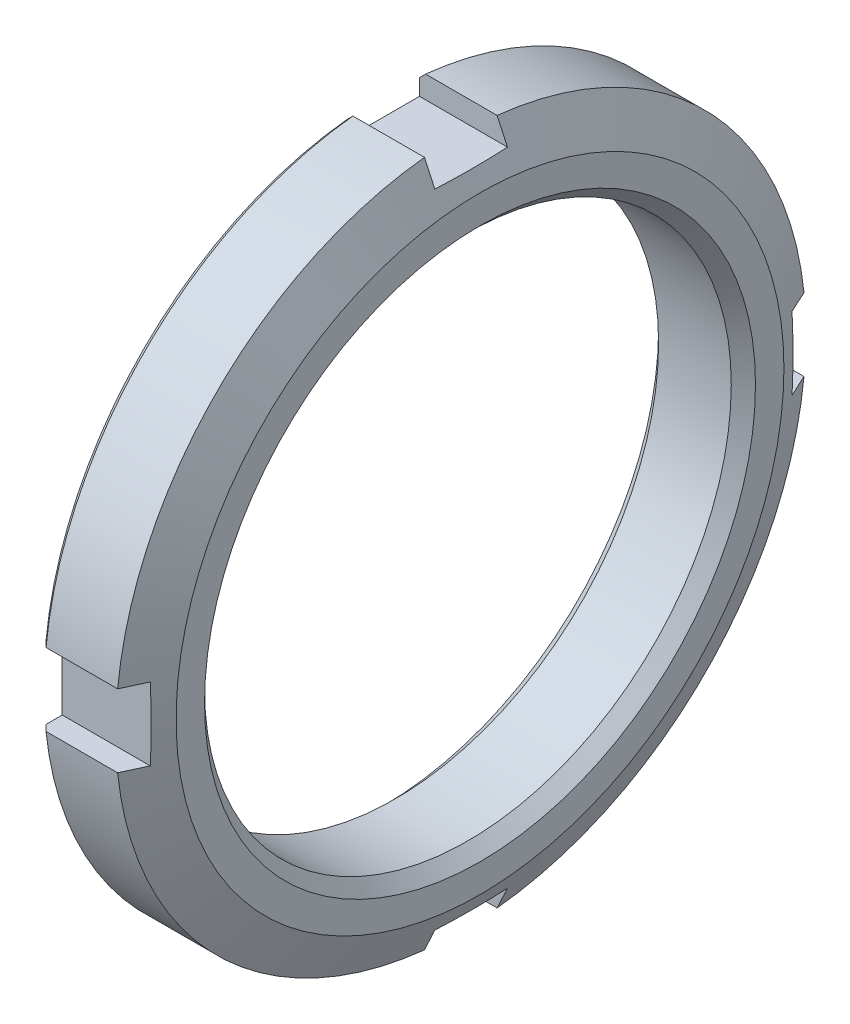
from build123d import *

# Parameters (mm, degrees)
SKETCH_1_R               = 28.5
SKETCH_1_R_2             = 21.75
EXTRUDE_1_DEPTH          = 8
CHAMFER_1_SIZE           = 1
CHAMFER_2_SIZE           = 0.5
CUT_EXTRUDE_START        = -8
CUT_EXTRUDE_1_DEPTH      = 8
PATTERN_CIRCULAR_1_COUNT = 4


with BuildPart() as part:
    # 草图1 → 凸台-拉伸1 (new body)
    with BuildSketch(Plane(origin=(0, 0, 0), x_dir=(0, 0, -1), z_dir=(1, 0, 0))):
        Circle(SKETCH_1_R)
        Circle(SKETCH_1_R_2, mode=Mode.SUBTRACT)
    extrude(amount=EXTRUDE_1_DEPTH)

    # 倒角1
    chamfer_1_edges = [part.edges().sort_by_distance(p)[0] for p in [
        (0, 0, 21.75),
        (8, 0, 21.75),
    ]]
    chamfer(chamfer_1_edges, length=CHAMFER_1_SIZE)

    # 倒角2
    chamfer_2_edges = [part.edges().sort_by_distance(p)[0] for p in [
        (0, 0, 28.5),
    ]]
    chamfer(chamfer_2_edges, length=CHAMFER_2_SIZE)

    # 草图2 → 切除-拉伸1 (cut)
    with BuildSketch(Plane(origin=(8, 0, 0), x_dir=(0, 0, -1), z_dir=(1, 0, 0)).offset(CUT_EXTRUDE_START)):
        with BuildLine():
            Line((-3, 28.341665442), (-3, 26.5))
            Line((-3, 26.5), (3, 26.5))
            Line((3, 26.5), (3, 28.341665442))
            ThreePointArc((3, 28.341665442), (0, 28.5), (-3, 28.341665442))
        make_face()
    cut_extrude_1 = extrude(amount=CUT_EXTRUDE_1_DEPTH, mode=Mode.SUBTRACT)

    # 阵列(圆周)1: 切除-拉伸1 ×4 about axis
    pattern_circular_1_axis = Axis((0, 0, 0), (1, 0, 0))
    for i in range(1, PATTERN_CIRCULAR_1_COUNT):
        add(cut_extrude_1.rotate(pattern_circular_1_axis, i * 360 / PATTERN_CIRCULAR_1_COUNT), mode=Mode.SUBTRACT)

    # 草图3 → 切除-旋转1 (revolve, cut)
    with BuildSketch(Plane.XY, mode=Mode.PRIVATE) as cut_revolve_1_sk:
        Polygon((3.295131606, 35.18962283), (8, 25.1), (8, 35.18962283), align=None)
    revolve(cut_revolve_1_sk.sketch.rotate(Axis((8, 0, 0), (-1, 0, 0)), 276.042328419), axis=Axis((8, 0, 0), (-1, 0, 0)), mode=Mode.SUBTRACT)


solid = part.part
